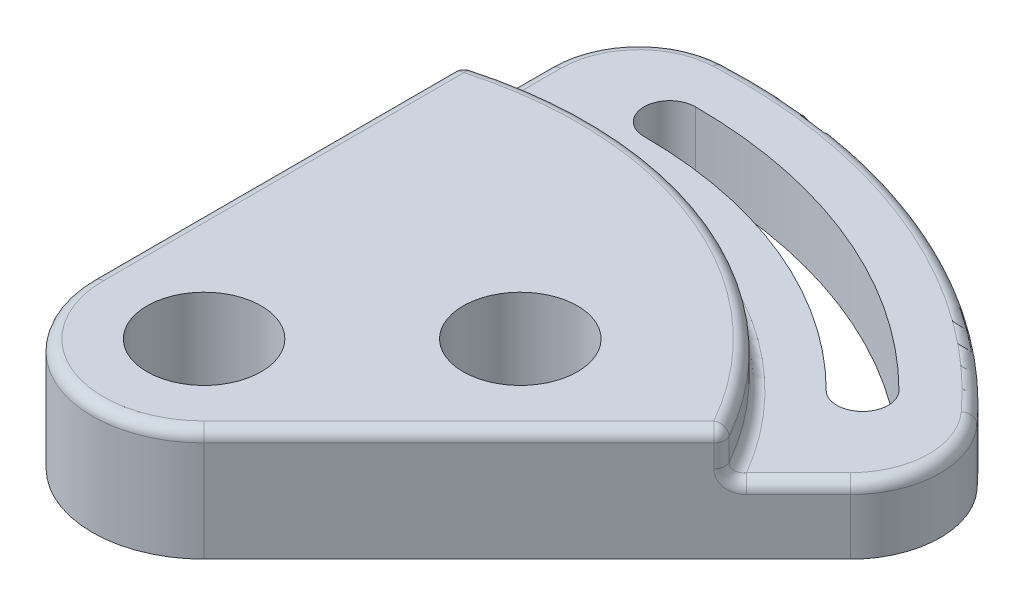
from build123d import *

# Parameters (mm, degrees)
SKETCH1_R           = 2.555
BOSS_EXTRUDE1_DEPTH = 5
FILLET1_R           = 4
CUT_EXTRUDE1_START  = -2
CUT_EXTRUDE1_DEPTH  = 2
FILLET3_R           = 0.5


with BuildPart() as part:
    # Sketch1 → Boss-Extrude1 (new body)
    with BuildSketch(Plane(origin=(0, 0, 0), x_dir=(1, 0, 0), z_dir=(0, 1, 0))):
        with BuildLine():
            Line((-5, 0), (-5, 23.957730656))
            ThreePointArc((-5, 23.957730656), (9.365764476, 22.610955619), (20.476207715, 13.405139903))
            Line((20.476207715, 13.405139903), (3.535533906, -3.535533906))
            ThreePointArc((3.535533906, -3.535533906), (-1.913417162, -4.619397663), (-5, 0))
        make_face()
        with Locations(Location((0, 0, 0), (0, 0, 270))):
            Circle(SKETCH1_R, mode=Mode.SUBTRACT)
        with Locations(Location((7.071067812, 7.071067812, 0), (0, 0, 270))):
            Circle(SKETCH1_R, mode=Mode.SUBTRACT)
        with BuildLine():
            ThreePointArc((0, 21.973922003), (-1.15, 20.823922003), (0, 19.673922003))
            ThreePointArc((0, 19.673922003), (7.528884, 18.176333863), (13.911563661, 13.911563661))
            ThreePointArc((13.911563661, 13.911563661), (15.537909258, 13.911563661), (15.537909258, 15.537909258))
            ThreePointArc((15.537909258, 15.537909258), (8.409055895, 20.301256788), (0, 21.973922003))
        make_face(mode=Mode.SUBTRACT)
    extrude(amount=BOSS_EXTRUDE1_DEPTH)

    # Fillet1
    fillet1_edges = [part.edges().sort_by_distance(p)[0] for p in [
        (-5, 2.5, -23.957730656),
        (20.476207715, 2.5, -13.405139903),
    ]]
    fillet(fillet1_edges, radius=FILLET1_R)

    # Sketch2 → Cut-Extrude1 (cut)
    # profile 1 of 3: a face of its own
    with BuildSketch(Plane(origin=(0, 5, 0), x_dir=(1, 0, 0), z_dir=(0, 1, 0)).offset(CUT_EXTRUDE1_START)):
        with BuildLine():
            ThreePointArc((17.995504206, 10.924436395), (18.929126851, 12.393826533), (19.150132948, 14.120648738))
            ThreePointArc((19.150132948, 14.120648738), (16.926987938, 10.570555283), (12.842220443, 11.498031317))
            ThreePointArc((12.842220443, 11.498031317), (14.122014888, 9.884130998), (15.200167421, 8.129099609))
            Line((15.200167421, 8.129099609), (17.995504206, 10.924436395))
        make_face()
    # profile 2 of 3: a face of its own
    with BuildSketch(Plane(origin=(0, 5, 0), x_dir=(1, 0, 0), z_dir=(0, 1, 0)).offset(CUT_EXTRUDE1_START)):
        with BuildLine():
            ThreePointArc((19.150132948, 14.120648738), (18.82866037, 15.363083326), (18.130276234, 16.439767087))
            ThreePointArc((18.130276234, 16.439767087), (9.365764476, 22.610955619), (-1.195370482, 24.444712058))
            ThreePointArc((-1.195370482, 24.444712058), (-2.450533029, 24.177213828), (-3.556382391, 23.525995345))
            ThreePointArc((-3.556382391, 23.525995345), (-4.494676634, 19.443699277), (-0.950485246, 17.211157075))
            ThreePointArc((-0.950485246, 17.211157075), (6.59646064, 15.925264742), (12.842220443, 11.498031317))
            ThreePointArc((12.842220443, 11.498031317), (16.926987938, 10.570555283), (19.150132948, 14.120648738))
        make_face()
        with BuildLine():
            ThreePointArc((0, 19.673922003), (-1.15, 20.823922003), (0, 21.973922003))
            ThreePointArc((0, 21.973922003), (8.409055895, 20.301256788), (15.537909258, 15.537909258))
            ThreePointArc((15.537909258, 15.537909258), (15.537909258, 13.911563661), (13.911563661, 13.911563661))
            ThreePointArc((13.911563661, 13.911563661), (7.528884, 18.176333863), (0, 19.673922003))
        make_face(mode=Mode.SUBTRACT)
    # profile 3 of 3: a face of its own
    with BuildSketch(Plane(origin=(0, 5, 0), x_dir=(1, 0, 0), z_dir=(0, 1, 0)).offset(CUT_EXTRUDE1_START)):
        with BuildLine():
            ThreePointArc((-0.950485246, 17.211157075), (-4.494676634, 19.443699277), (-3.556382391, 23.525995345))
            ThreePointArc((-3.556382391, 23.525995345), (-4.621155172, 22.148672745), (-5, 20.44948611))
            Line((-5, 20.44948611), (-5, 16.496282917))
            ThreePointArc((-5, 16.496282917), (-2.996636437, 16.974908546), (-0.950485246, 17.211157075))
        make_face()
    extrude(amount=CUT_EXTRUDE1_DEPTH, mode=Mode.SUBTRACT)

    # Fillet3
    fillet3_edges = [part.edges().sort_by_distance(p)[0] for p in [
        (-1.913417162, 5, 4.619397663),
        (-5, 5, -8.248141459),
        (19.165883391, 3, -13.655149118),
        (16.597835814, 3, -9.526768002),
        (6.59646064, 3, -15.925264742),
        (15.200167421, 4, -8.129099609),
        (-5, 3, -18.472884514),
        (-5, 4, -16.496282917),
        (-3.896677573, 3, -23.207974653),
        (9.365764476, 3, -22.610955619),
        (6.59646064, 5, -15.925264742),
        (9.367850663, 5, -2.296782852),
    ]]
    fillet(fillet3_edges, radius=FILLET3_R)


solid = part.part
